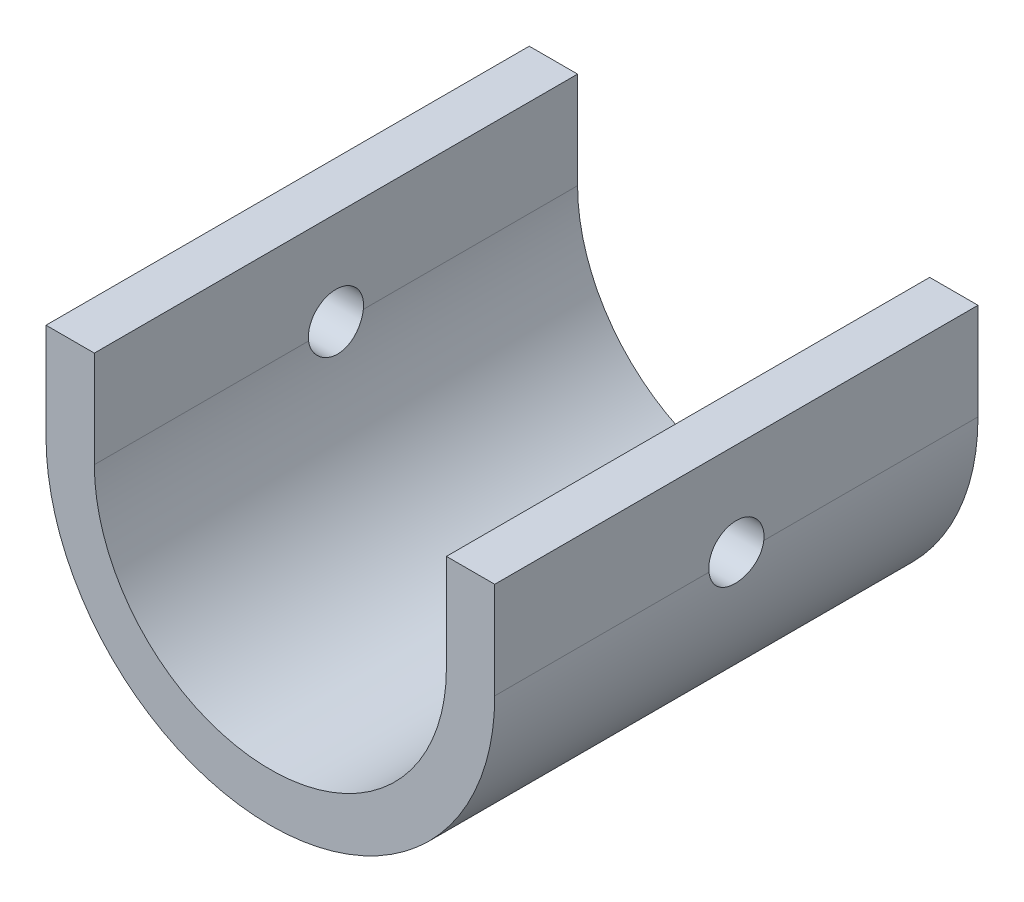
from build123d import *

# Parameters (mm, degrees)
SKETCH1_R           = 16.25
BOSS_EXTRUDE1_DEPTH = 35
SKETCH2_R           = 12.75
CUT_EXTRUDE1_DEPTH  = 35
SKETCH7_W           = 32.720020464
SKETCH7_H           = 16.591035764
CUT_EXTRUDE2_DEPTH  = 17.5
SKETCH9_W           = 32.5
SKETCH9_H           = 35
BOSS_EXTRUDE2_DEPTH = 7
SKETCH10_W          = 25.5
SKETCH10_H          = 35
CUT_EXTRUDE3_DEPTH  = 7
SKETCH15_R          = 2
CUT_EXTRUDE5_DEPTH  = 4
CUT_EXTRUDE6_START  = -4
SKETCH14_R          = 2
CUT_EXTRUDE6_DEPTH  = 4


with BuildPart() as part:
    # Sketch1 → Boss-Extrude1 (new body)
    with BuildSketch(Plane.XY):
        Circle(SKETCH1_R)
    extrude(amount=-BOSS_EXTRUDE1_DEPTH)

    # Sketch2 → Cut-Extrude1 (cut)
    with BuildSketch(Plane.XY):
        Circle(SKETCH2_R)
    extrude(amount=-CUT_EXTRUDE1_DEPTH, mode=Mode.SUBTRACT)

    # Sketch7 → Cut-Extrude2 (cut, symmetric)
    with BuildSketch(Plane.XY.offset(-17.5)):
        with Locations((-0.110010232, 8.295517882)):
            Rectangle(SKETCH7_W, SKETCH7_H)
    extrude(amount=CUT_EXTRUDE2_DEPTH, both=True, mode=Mode.SUBTRACT)

    # Sketch9 → Boss-Extrude2 (add)
    with BuildSketch(Plane(origin=(0, 0, 0), x_dir=(1, 0, 0), z_dir=(0, 1, 0))):
        with Locations((0, 17.5)):
            Rectangle(SKETCH9_W, SKETCH9_H)
    extrude(amount=BOSS_EXTRUDE2_DEPTH)

    # Sketch10 → Cut-Extrude3 (cut)
    with BuildSketch(Plane(origin=(0, 0, 0), x_dir=(1, 0, 0), z_dir=(0, 1, 0))):
        with Locations((0, 17.5)):
            Rectangle(SKETCH10_W, SKETCH10_H)
    extrude(amount=CUT_EXTRUDE3_DEPTH, mode=Mode.SUBTRACT)

    # Sketch15 → Cut-Extrude5 (cut)
    with BuildSketch(Plane(origin=(-16.25, 0, 0), x_dir=(0, 0, -1), z_dir=(1, 0, 0))):
        with Locations(Location((17.5, 0.25, 0), (0, 0, 187.180755781))):
            Circle(SKETCH15_R)
    extrude(amount=CUT_EXTRUDE5_DEPTH, mode=Mode.SUBTRACT)

    # Sketch14 → Cut-Extrude6 (cut)
    with BuildSketch(Plane(origin=(16.25, 0, 0), x_dir=(0, 0, -1), z_dir=(1, 0, 0)).offset(CUT_EXTRUDE6_START)):
        with Locations(Location((17.5, 0.25, 0), (0, 0, 187.180755781))):
            Circle(SKETCH14_R)
    extrude(amount=CUT_EXTRUDE6_DEPTH, mode=Mode.SUBTRACT)


solid = part.part
